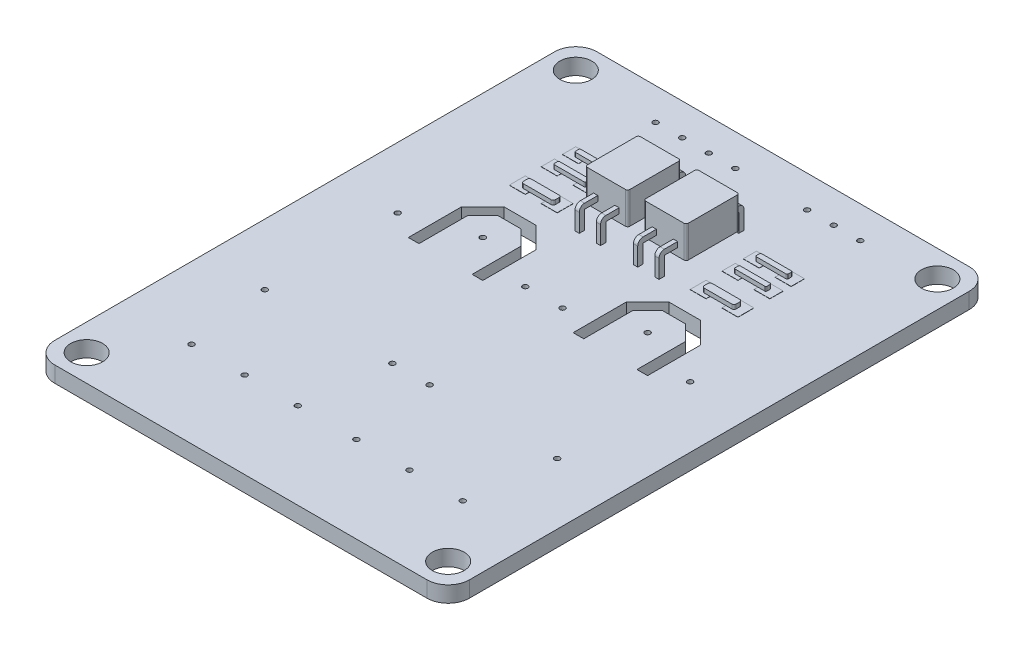
from build123d import *

# Parameters (mm, degrees)
IZIM1_R                          = 1.5
IZIM1_R_2                        = 0.25
Y_KSEKLIK_EKSTR_ZYON1_DEPTH      = 1.5
IZIM2_W                          = 1.5
IZIM2_H                          = 1.5
IZIM2_H_2                        = 1.25
Y_KSEKLIK_EKSTR_ZYON2_DEPTH      = 0.02
Y_KSEKLIK_EKSTR_ZYON3_DEPTH      = 0.4
Y_KSEKLIK_EKSTR_ZYON4_DEPTH      = 3
Y_KSEKLIK_EKSTR_ZYON4_2_DEPTH    = 3
Y_KSEKLIK_EKSTR_ZYON5_DEPTH      = 0.2
Y_KSEKLIK_EKSTR_ZYON5_DEPTH_BACK = 0.2
Y_KSEKLIK_EKSTR_ZYON6_DEPTH      = 0.2
Y_KSEKLIK_EKSTR_ZYON6_DEPTH_BACK = 0.2
Y_KSEKLIK_EKSTR_ZYON7_DEPTH      = 0.2
Y_KSEKLIK_EKSTR_ZYON7_DEPTH_BACK = 0.2
Y_KSEKLIK_EKSTR_ZYON8_DEPTH      = 0.2
Y_KSEKLIK_EKSTR_ZYON8_DEPTH_BACK = 0.2


with BuildPart() as part:
    # Çizim1 → Yükseklik-Ekstrüzyon1 (new body)
    with BuildSketch(Plane(origin=(0, 0, 0), x_dir=(1, 0, 0), z_dir=(0, 1, 0))):
        with BuildLine():
            Line((-17.5, 25.5), (17.5, 25.5))
            ThreePointArc((17.5, 25.5), (18.914213562, 24.914213562), (19.5, 23.5))
            Line((19.5, 23.5), (19.5, -23.5))
            ThreePointArc((19.5, -23.5), (18.914213562, -24.914213562), (17.5, -25.5))
            Line((17.5, -25.5), (-17.5, -25.5))
            ThreePointArc((-17.5, -25.5), (-18.914213562, -24.914213562), (-19.5, -23.5))
            Line((-19.5, -23.5), (-19.5, 23.5))
            ThreePointArc((-19.5, 23.5), (-18.914213562, 24.914213562), (-17.5, 25.5))
        make_face()
        with Locations(Location((-17, 23, 0), (0, 0, 270))):
            Circle(IZIM1_R, mode=Mode.SUBTRACT)
        with Locations(Location((17, 23, 0), (0, 0, 90))):
            Circle(IZIM1_R, mode=Mode.SUBTRACT)
        with Locations(Location((17, -23, 0), (0, 0, 270))):
            Circle(IZIM1_R, mode=Mode.SUBTRACT)
        with Locations(Location((-17, -23, 0), (0, 0, 90))):
            Circle(IZIM1_R, mode=Mode.SUBTRACT)
        with Locations(Location((-13.75, -9.5, 0), (0, 0, 270))):
            Circle(IZIM1_R_2, mode=Mode.SUBTRACT)
        with Locations(Location((-1.75, -9.5, 0), (0, 0, 270))):
            Circle(IZIM1_R_2, mode=Mode.SUBTRACT)
        with Locations(Location((-13.75, 3, 0), (0, 0, 270))):
            Circle(IZIM1_R_2, mode=Mode.SUBTRACT)
        with Locations(Location((-7.75, 5, 0), (0, 0, 270))):
            Circle(IZIM1_R_2, mode=Mode.SUBTRACT)
        with Locations(Location((-1.75, 3, 0), (0, 0, 270))):
            Circle(IZIM1_R_2, mode=Mode.SUBTRACT)
        with Locations(Location((13.75, 3, 0), (0, 0, 90))):
            Circle(IZIM1_R_2, mode=Mode.SUBTRACT)
        with Locations(Location((7.75, 5, 0), (0, 0, 90))):
            Circle(IZIM1_R_2, mode=Mode.SUBTRACT)
        with Locations(Location((1.75, 3, 0), (0, 0, 90))):
            Circle(IZIM1_R_2, mode=Mode.SUBTRACT)
        with Locations(Location((1.75, -9.5, 0), (0, 0, 90))):
            Circle(IZIM1_R_2, mode=Mode.SUBTRACT)
        with Locations(Location((13.75, -9.5, 0), (0, 0, 90))):
            Circle(IZIM1_R_2, mode=Mode.SUBTRACT)
        with Locations(Location((-7.75, -17.39, 0), (0, 0, 270))):
            Circle(IZIM1_R_2, mode=Mode.SUBTRACT)
        with Locations(Location((-2.75, -17.39, 0), (0, 0, 270))):
            Circle(IZIM1_R_2, mode=Mode.SUBTRACT)
        with Locations(Location((-12.75, -17.39, 0), (0, 0, 270))):
            Circle(IZIM1_R_2, mode=Mode.SUBTRACT)
        with Locations(Location((2.75, -17.39, 0), (0, 0, 90))):
            Circle(IZIM1_R_2, mode=Mode.SUBTRACT)
        with Locations(Location((7.75, -17.39, 0), (0, 0, 90))):
            Circle(IZIM1_R_2, mode=Mode.SUBTRACT)
        with Locations(Location((12.75, -17.39, 0), (0, 0, 90))):
            Circle(IZIM1_R_2, mode=Mode.SUBTRACT)
        with Locations(Location((-1.5, 22.5, 0), (0, 0, 270))):
            Circle(IZIM1_R_2, mode=Mode.SUBTRACT)
        with Locations(Location((-4, 22.5, 0), (0, 0, 270))):
            Circle(IZIM1_R_2, mode=Mode.SUBTRACT)
        with Locations(Location((-6.5, 22.5, 0), (0, 0, 270))):
            Circle(IZIM1_R_2, mode=Mode.SUBTRACT)
        with Locations(Location((-9, 22.5, 0), (0, 0, 270))):
            Circle(IZIM1_R_2, mode=Mode.SUBTRACT)
        with Locations(Location((7.75, 22.5, 0), (0, 0, 270))):
            Circle(IZIM1_R_2, mode=Mode.SUBTRACT)
        with Locations(Location((10.25, 22.5, 0), (0, 0, 270))):
            Circle(IZIM1_R_2, mode=Mode.SUBTRACT)
        with Locations(Location((5.25, 22.5, 0), (0, 0, 270))):
            Circle(IZIM1_R_2, mode=Mode.SUBTRACT)
        Polygon((-11.25, 6.5), (-9.25, 8.5), (-6.25, 8.5), (-4.25, 6.5), (-4.25, 1.5), (-5.25, 1.5), (-5.25, 6.085786438), (-6.664213562, 7.5), (-8.835786438, 7.5), (-10.25, 6.085786438), (-10.25, 1.5), (-11.25, 1.5), align=None, mode=Mode.SUBTRACT)
        Polygon((5.25, 1.5), (4.25, 1.5), (4.25, 6.5), (6.25, 8.5), (9.25, 8.5), (11.25, 6.5), (11.25, 1.5), (10.25, 1.5), (10.25, 6.085786438), (8.835786438, 7.5), (6.664213562, 7.5), (5.25, 6.085786438), align=None, mode=Mode.SUBTRACT)
    extrude(amount=Y_KSEKLIK_EKSTR_ZYON1_DEPTH)

    # Çizim2 → Yükseklik-Ekstrüzyon2 (add)
    with BuildSketch(Plane(origin=(0, 1.5, 0), x_dir=(1, 0, 0), z_dir=(0, 1, 0))):
        with Locations((7, 11.25)):
            Rectangle(IZIM2_W, IZIM2_H)
        with Locations((-7, 11.25)):
            Rectangle(IZIM2_W, IZIM2_H)
        with Locations((-10, 11.25)):
            Rectangle(IZIM2_W, IZIM2_H)
        with Locations((-7, 14.125)):
            Rectangle(IZIM2_W, IZIM2_H_2)
        with Locations((-10, 14.125)):
            Rectangle(IZIM2_W, IZIM2_H_2)
        with Locations((-7, 16.125)):
            Rectangle(IZIM2_W, IZIM2_H_2)
        with Locations((-10, 16.125)):
            Rectangle(IZIM2_W, IZIM2_H_2)
        with Locations((10, 11.25)):
            Rectangle(IZIM2_W, IZIM2_H)
        with Locations((7, 14.125)):
            Rectangle(IZIM2_W, IZIM2_H_2)
        with Locations((10, 14.125)):
            Rectangle(IZIM2_W, IZIM2_H_2)
        with Locations((7, 16.125)):
            Rectangle(IZIM2_W, IZIM2_H_2)
        with Locations((10, 16.125)):
            Rectangle(IZIM2_W, IZIM2_H_2)
    extrude(amount=Y_KSEKLIK_EKSTR_ZYON2_DEPTH)

    # Çizim3 → Yükseklik-Ekstrüzyon3 (add)
    with BuildSketch(Plane(origin=(0, 1.52, 0), x_dir=(1, 0, 0), z_dir=(0, 1, 0))):
        with BuildLine():
            Line((-9.9, 16.375), (-7.1, 16.375))
            ThreePointArc((-7.1, 16.375), (-7.029289322, 16.345710678), (-7, 16.275))
            Line((-7, 16.275), (-7, 15.975))
            ThreePointArc((-7, 15.975), (-7.029289322, 15.904289322), (-7.1, 15.875))
            Line((-7.1, 15.875), (-9.9, 15.875))
            ThreePointArc((-9.9, 15.875), (-9.970710678, 15.904289322), (-10, 15.975))
            Line((-10, 15.975), (-10, 16.275))
            ThreePointArc((-10, 16.275), (-9.970710678, 16.345710678), (-9.9, 16.375))
        make_face()
        with BuildLine():
            Line((-9.9, 14.375), (-7.1, 14.375))
            ThreePointArc((-7.1, 14.375), (-7.029289322, 14.345710678), (-7, 14.275))
            Line((-7, 14.275), (-7, 13.975))
            ThreePointArc((-7, 13.975), (-7.029289322, 13.904289322), (-7.1, 13.875))
            Line((-7.1, 13.875), (-9.9, 13.875))
            ThreePointArc((-9.9, 13.875), (-9.970710678, 13.904289322), (-10, 13.975))
            Line((-10, 13.975), (-10, 14.275))
            ThreePointArc((-10, 14.275), (-9.970710678, 14.345710678), (-9.9, 14.375))
        make_face()
        with BuildLine():
            Line((-9.8, 11.625), (-7.2, 11.625))
            ThreePointArc((-7.2, 11.625), (-7.058578644, 11.566421356), (-7, 11.425))
            Line((-7, 11.425), (-7, 11.075))
            ThreePointArc((-7, 11.075), (-7.058578644, 10.933578644), (-7.2, 10.875))
            Line((-7.2, 10.875), (-9.8, 10.875))
            ThreePointArc((-9.8, 10.875), (-9.941421356, 10.933578644), (-10, 11.075))
            Line((-10, 11.075), (-10, 11.425))
            ThreePointArc((-10, 11.425), (-9.941421356, 11.566421356), (-9.8, 11.625))
        make_face()
        with BuildLine():
            Line((9.9, 15.875), (7.1, 15.875))
            ThreePointArc((7.1, 15.875), (7.029289322, 15.904289322), (7, 15.975))
            Line((7, 15.975), (7, 16.275))
            ThreePointArc((7, 16.275), (7.029289322, 16.345710678), (7.1, 16.375))
            Line((7.1, 16.375), (9.9, 16.375))
            ThreePointArc((9.9, 16.375), (9.970710678, 16.345710678), (10, 16.275))
            Line((10, 16.275), (10, 15.975))
            ThreePointArc((10, 15.975), (9.970710678, 15.904289322), (9.9, 15.875))
        make_face()
        with BuildLine():
            Line((9.9, 13.875), (7.1, 13.875))
            ThreePointArc((7.1, 13.875), (7.029289322, 13.904289322), (7, 13.975))
            Line((7, 13.975), (7, 14.275))
            ThreePointArc((7, 14.275), (7.029289322, 14.345710678), (7.1, 14.375))
            Line((7.1, 14.375), (9.9, 14.375))
            ThreePointArc((9.9, 14.375), (9.970710678, 14.345710678), (10, 14.275))
            Line((10, 14.275), (10, 13.975))
            ThreePointArc((10, 13.975), (9.970710678, 13.904289322), (9.9, 13.875))
        make_face()
        with BuildLine():
            Line((9.8, 10.875), (7.2, 10.875))
            ThreePointArc((7.2, 10.875), (7.058578644, 10.933578644), (7, 11.075))
            Line((7, 11.075), (7, 11.425))
            ThreePointArc((7, 11.425), (7.058578644, 11.566421356), (7.2, 11.625))
            Line((7.2, 11.625), (9.8, 11.625))
            ThreePointArc((9.8, 11.625), (9.941421356, 11.566421356), (10, 11.425))
            Line((10, 11.425), (10, 11.075))
            ThreePointArc((10, 11.075), (9.941421356, 10.933578644), (9.8, 10.875))
        make_face()
    extrude(amount=Y_KSEKLIK_EKSTR_ZYON3_DEPTH)



with BuildPart() as body_2:
    # Çizim5 → Yükseklik-Ekstrüzyon4 (new body)
    with BuildSketch(Plane(origin=(0, 2.5, 0), x_dir=(1, 0, 0), z_dir=(0, 1, 0))):
        with BuildLine():
            Line((4.55, 11.625), (0.95, 11.625))
            ThreePointArc((0.95, 11.625), (0.808578644, 11.683578644), (0.75, 11.825))
            Line((0.75, 11.825), (0.75, 16.425))
            ThreePointArc((0.75, 16.425), (0.808578644, 16.566421356), (0.95, 16.625))
            Line((0.95, 16.625), (4.55, 16.625))
            ThreePointArc((4.55, 16.625), (4.691421356, 16.566421356), (4.75, 16.425))
            Line((4.75, 16.425), (4.75, 11.825))
            ThreePointArc((4.75, 11.825), (4.691421356, 11.683578644), (4.55, 11.625))
        make_face()
    extrude(amount=Y_KSEKLIK_EKSTR_ZYON4_DEPTH)


with BuildPart() as body_3:
    # Çizim5 → Y_kseklik-Ekstr_zyon4 2 (new body)
    with BuildSketch(Plane(origin=(0, 2.5, 0), x_dir=(1, 0, 0), z_dir=(0, 1, 0))):
        with BuildLine():
            Line((-4.55, 16.625), (-0.95, 16.625))
            ThreePointArc((-0.95, 16.625), (-0.808578644, 16.566421356), (-0.75, 16.425))
            Line((-0.75, 16.425), (-0.75, 11.825))
            ThreePointArc((-0.75, 11.825), (-0.808578644, 11.683578644), (-0.95, 11.625))
            Line((-0.95, 11.625), (-4.55, 11.625))
            ThreePointArc((-4.55, 11.625), (-4.691421356, 11.683578644), (-4.75, 11.825))
            Line((-4.75, 11.825), (-4.75, 16.425))
            ThreePointArc((-4.75, 16.425), (-4.691421356, 16.566421356), (-4.55, 16.625))
        make_face()
    extrude(amount=Y_KSEKLIK_EKSTR_ZYON4_2_DEPTH)


with BuildPart() as part_1:
    add(part.part)

    add(body_3.part)  # Yükseklik-Ekstrüzyon5 merges body 3
    # Çizim8 → Yükseklik-Ekstrüzyon5 (add, two sides: drawn at the far end of the back side and taken through both)
    with BuildSketch(Plane.ZY.offset(3.75).offset(-Y_KSEKLIK_EKSTR_ZYON5_DEPTH_BACK)):
        with BuildLine():
            Line((-17.375, 3.210871737), (-10.375, 3.210871737))
            Line((-10.375, 3.210871737), (-10.375, 0.798774868))
            Line((-10.375, 0.798774868), (-9.875, 0.798774868))
            Line((-9.875, 0.798774868), (-9.875, 3.210871737))
            ThreePointArc((-9.875, 3.210871737), (-10.021446609, 3.564425128), (-10.375, 3.710871737))
            Line((-10.375, 3.710871737), (-17.375, 3.710871737))
            ThreePointArc((-17.375, 3.710871737), (-17.728553391, 3.564425128), (-17.875, 3.210871737))
            Line((-17.875, 3.210871737), (-17.875, 0.798774868))
            Line((-17.875, 0.798774868), (-17.375, 0.798774868))
            Line((-17.375, 0.798774868), (-17.375, 3.210871737))
        make_face()
    extrude(amount=Y_KSEKLIK_EKSTR_ZYON5_DEPTH + Y_KSEKLIK_EKSTR_ZYON5_DEPTH_BACK)

    # Çizim9 → Yükseklik-Ekstrüzyon6 (add, two sides: drawn at the far end of the back side and taken through both)
    with BuildSketch(Plane(origin=(-1.75, 0, 0), x_dir=(0, 0, -1), z_dir=(1, 0, 0)).offset(-Y_KSEKLIK_EKSTR_ZYON6_DEPTH_BACK)):
        with BuildLine():
            Line((10.378377538, 0.559357084), (10.378377538, 3.210871737))
            Line((10.378377538, 3.210871737), (17.371622462, 3.210871737))
            Line((17.371622462, 3.210871737), (17.371622462, 0.559357084))
            Line((17.371622462, 0.559357084), (17.871622462, 0.559357084))
            Line((17.871622462, 0.559357084), (17.871622462, 3.210871737))
            ThreePointArc((17.871622462, 3.210871737), (17.725175853, 3.564425128), (17.371622462, 3.710871737))
            Line((17.371622462, 3.710871737), (10.378377538, 3.710871737))
            ThreePointArc((10.378377538, 3.710871737), (10.024824147, 3.564425128), (9.878377538, 3.210871737))
            Line((9.878377538, 3.210871737), (9.878377538, 0.559357084))
            Line((9.878377538, 0.559357084), (10.378377538, 0.559357084))
        make_face()
    extrude(amount=Y_KSEKLIK_EKSTR_ZYON6_DEPTH + Y_KSEKLIK_EKSTR_ZYON6_DEPTH_BACK)


    add(body_2.part)  # Yükseklik-Ekstrüzyon7 merges body 2
    # Çizim10 → Yükseklik-Ekstrüzyon7 (add, two sides: drawn at the far end of the back side and taken through both)
    with BuildSketch(Plane(origin=(3.75, 0, 0), x_dir=(0, 0, -1), z_dir=(1, 0, 0)).offset(-Y_KSEKLIK_EKSTR_ZYON7_DEPTH_BACK)):
        with BuildLine():
            Line((10.375, 0.625240508), (10.375, 3.2127649))
            Line((10.375, 3.2127649), (17.375, 3.2127649))
            Line((17.375, 3.2127649), (17.375, 0.625240508))
            Line((17.375, 0.625240508), (17.875, 0.625240508))
            Line((17.875, 0.625240508), (17.875, 3.2127649))
            ThreePointArc((17.875, 3.2127649), (17.728553391, 3.56631829), (17.375, 3.7127649))
            Line((17.375, 3.7127649), (10.375, 3.7127649))
            ThreePointArc((10.375, 3.7127649), (10.021446609, 3.56631829), (9.875, 3.2127649))
            Line((9.875, 3.2127649), (9.875, 0.625240508))
            Line((9.875, 0.625240508), (10.375, 0.625240508))
        make_face()
    extrude(amount=Y_KSEKLIK_EKSTR_ZYON7_DEPTH + Y_KSEKLIK_EKSTR_ZYON7_DEPTH_BACK)

    # Çizim11 → Yükseklik-Ekstrüzyon8 (add, two sides: drawn at the far end of the back side and taken through both)
    with BuildSketch(Plane.ZY.offset(-1.75).offset(-Y_KSEKLIK_EKSTR_ZYON8_DEPTH_BACK)):
        with BuildLine():
            Line((-17.375, 0.555982075), (-17.375, 3.210871737))
            Line((-17.375, 3.210871737), (-10.375, 3.210871737))
            Line((-10.375, 3.210871737), (-10.375, 0.555982075))
            Line((-10.375, 0.555982075), (-9.875, 0.555982075))
            Line((-9.875, 0.555982075), (-9.875, 3.210871737))
            ThreePointArc((-9.875, 3.210871737), (-10.021446609, 3.564425128), (-10.375, 3.710871737))
            Line((-10.375, 3.710871737), (-17.375, 3.710871737))
            ThreePointArc((-17.375, 3.710871737), (-17.728553391, 3.564425128), (-17.875, 3.210871737))
            Line((-17.875, 3.210871737), (-17.875, 0.555982075))
            Line((-17.875, 0.555982075), (-17.375, 0.555982075))
        make_face()
    extrude(amount=Y_KSEKLIK_EKSTR_ZYON8_DEPTH + Y_KSEKLIK_EKSTR_ZYON8_DEPTH_BACK)


solid = part_1.part
